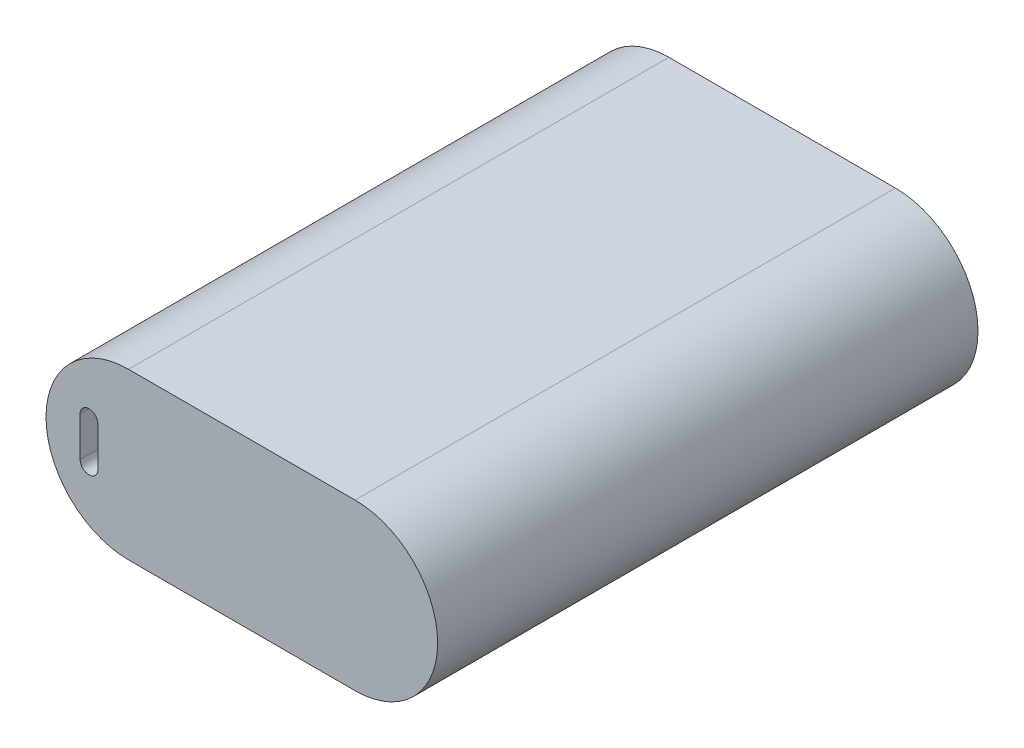
from build123d import *

# Parameters (mm, degrees)
P_IDAT_VYSUNUT_M1_DEPTH  = 79.2
SKICA2_W                 = 5.1
SKICA2_H                 = 13
ODEBRAT_VYSUNUT_M1_DEPTH = 10
ODEBRAT_VYSUNUT_M2_DEPTH = 6.65


with BuildPart() as part:
    # Skica1 → Přidat vysunutím1 (new body)
    with BuildSketch(Plane.XY):
        with BuildLine():
            Line((0, 24.2), (33.2, 24.2))
            ThreePointArc((33.2, 24.2), (45.3, 12.1), (33.2, 0))
            Line((33.2, 0), (0, 0))
            ThreePointArc((0, 0), (-12.1, 12.1), (0, 24.2))
        make_face()
    extrude(amount=P_IDAT_VYSUNUT_M1_DEPTH)

    # Skica2 → Odebrat vysunutím1 (cut)
    with BuildSketch(Plane(origin=(0, 0, 0), x_dir=(-1, 0, 0), z_dir=(0, 0, -1))):
        with Locations((5.15, 12.1)):
            Rectangle(SKICA2_W, SKICA2_H)
    extrude(amount=-ODEBRAT_VYSUNUT_M1_DEPTH, mode=Mode.SUBTRACT)

    # Skica3 → Odebrat vysunutím2 (cut)
    with BuildSketch(Plane.XY.offset(79.2)):
        with BuildLine():
            Line((-7.1, 9.2), (-7.1, 15))
            ThreePointArc((-7.1, 15), (-5.8, 16.3), (-4.5, 15))
            Line((-4.5, 15), (-4.5, 9.2))
            ThreePointArc((-4.5, 9.2), (-5.8, 7.9), (-7.1, 9.2))
        make_face()
    extrude(amount=-ODEBRAT_VYSUNUT_M2_DEPTH, mode=Mode.SUBTRACT)


solid = part.part
